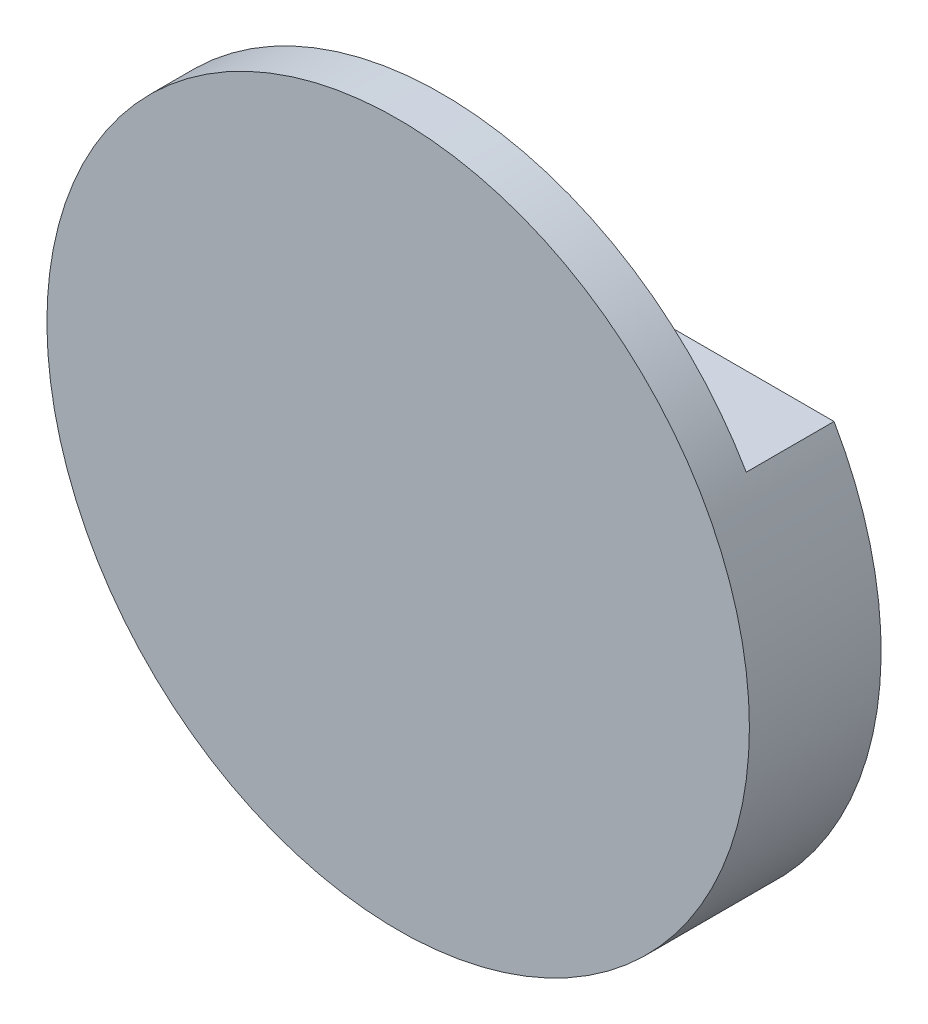
from build123d import *
from build123d.topology import SkipClean

# Parameters (mm, degrees)
BOSS_EXTRUDE1_DEPTH = 1.5875
SKETCH2_R           = 6.35
BOSS_EXTRUDE2_DEPTH = 0.79375
FILLET1_R           = 0.5


with BuildPart() as part:
    # Sketch1 → Boss-Extrude1 (new body)
    with BuildSketch(Plane.XY):
        with BuildLine():
            Line((-1.5875, 3.175), (-1.5875, 1.5875))
            Line((-1.5875, 1.5875), (-3.175, 1.5875))
            Line((-3.175, 1.5875), (-3.175, -1.5875))
            Line((-3.175, -1.5875), (-1.5875, -1.5875))
            Line((-1.5875, -1.5875), (-1.5875, -3.175))
            Line((-1.5875, -3.175), (1.5875, -3.175))
            Line((1.5875, -3.175), (1.5875, -1.5875))
            Line((1.5875, -1.5875), (3.175, -1.5875))
            Line((3.175, -1.5875), (3.175, 1.5875))
            Line((3.175, 1.5875), (1.5875, 1.5875))
            Line((1.5875, 1.5875), (1.5875, 3.175))
            Line((1.5875, 3.175), (5.499261314, 3.175))
            ThreePointArc((5.499261314, 3.175), (0, -6.35), (-5.499261314, 3.175))
            Line((-5.499261314, 3.175), (-1.5875, 3.175))
        make_face()
    extrude(amount=BOSS_EXTRUDE1_DEPTH)

    # Sketch2 → Boss-Extrude2 (add)
    with SkipClean():  # the faces are left unmerged after this step: merging them gives an invalid solid
        with BuildSketch(Plane.XY.offset(1.5875)):
            with Locations(Location((0, 0, 0), (0, 0, 150))):
                Circle(SKETCH2_R)
        extrude(amount=BOSS_EXTRUDE2_DEPTH)

    # Fillet1
    fillet1_edges = [part.edges().sort_by_distance(p)[0] for p in [
        (-1.5875, 1.5875, 0.79375),
        (-1.5875, -1.5875, 0.79375),
        (1.5875, -1.5875, 0.79375),
        (1.5875, 1.5875, 0.79375),
    ]]
    fillet(fillet1_edges, radius=FILLET1_R)


solid = part.part
